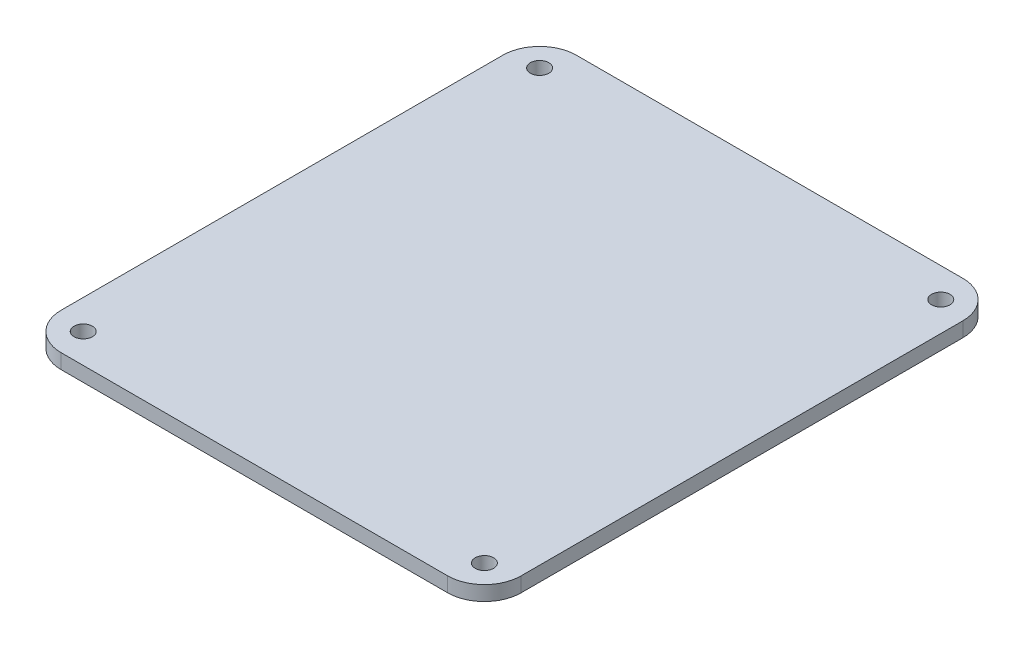
from build123d import *

# Parameters (mm, degrees)
SKETCH1_W           = 125
SKETCH1_H           = 140
BOSS_EXTRUDE1_DEPTH = 4
SKETCH2_R           = 2.5
CUT_EXTRUDE1_DEPTH  = 94.926833227
FILLET2_R           = 10


with BuildPart() as part:
    # Sketch1 → Boss-Extrude1 (new body)
    with BuildSketch(Plane(origin=(0, 0, 0), x_dir=(1, 0, 0), z_dir=(0, 1, 0))):
        Rectangle(SKETCH1_W, SKETCH1_H)
    extrude(amount=BOSS_EXTRUDE1_DEPTH)

    # Sketch2 → Cut-Extrude1 (cut, through all)
    with BuildSketch(Plane(origin=(0, 4, 0), x_dir=(1, 0, 0), z_dir=(0, 1, 0))):
        with Locations(Location((-54.5, 62, 0), (0, 0, 270))):
            Circle(SKETCH2_R)
        with Locations(Location((54.5, 62, 0), (0, 0, 270))):
            Circle(SKETCH2_R)
        with Locations(Location((54.5, -62, 0), (0, 0, 270))):
            Circle(SKETCH2_R)
        with Locations(Location((-54.5, -62, 0), (0, 0, 270))):
            Circle(SKETCH2_R)
    extrude(amount=-CUT_EXTRUDE1_DEPTH, mode=Mode.SUBTRACT)

    # Fillet2
    fillet2_edges = [part.edges().sort_by_distance(p)[0] for p in [
        (62.5, 2, 70),
        (-62.5, 2, 70),
        (-62.5, 2, -70),
        (62.5, 2, -70),
    ]]
    fillet(fillet2_edges, radius=FILLET2_R)


solid = part.part
